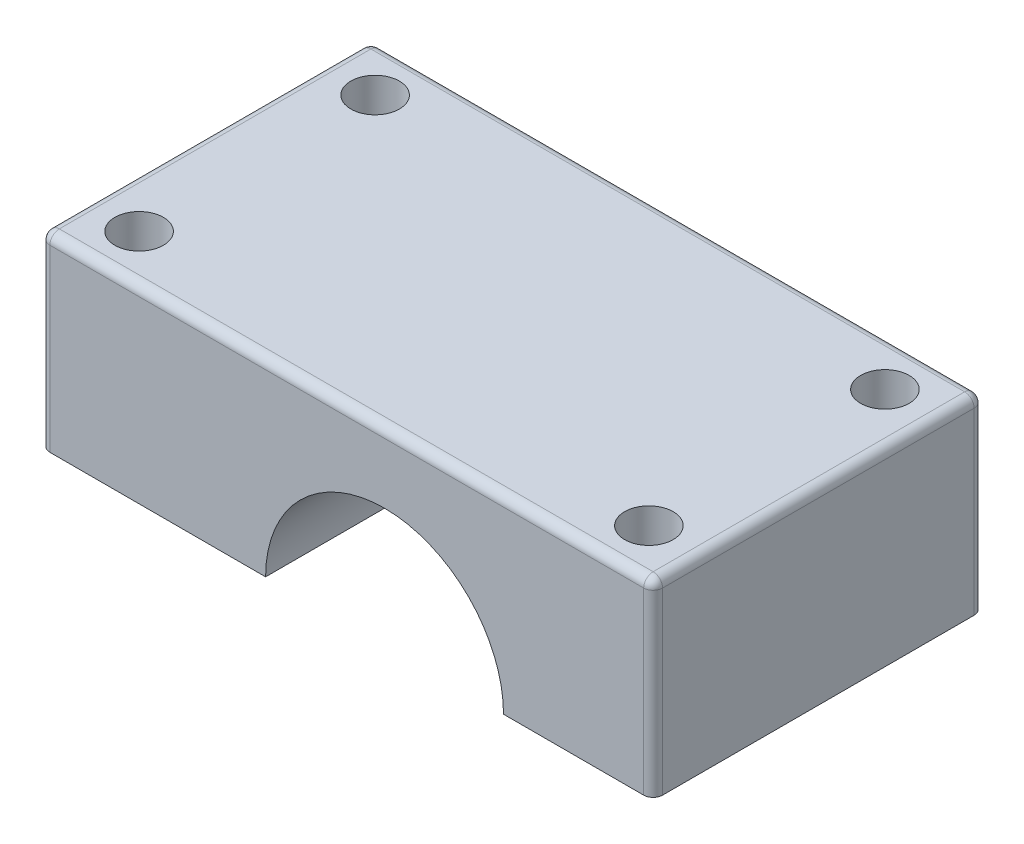
from build123d import *

# Parameters (mm, degrees)
SKETCH1_W               = 72.263
SKETCH1_H               = 44.45
BOSS_EXTRUDE1_DEPTH     = 12.7
CUT_EXTRUDE1_DEPTH      = 59.673484576
SKETCH3_W               = 44.45
SKETCH3_H               = 25.4
BOSS_EXTRUDE2_DEPTH     = 10.16
F_1_4_CLEARANCE_HOLE1_D = 6.5278
FILLET8_R               = 1.27


with BuildPart() as part:
    # Sketch1 → Boss-Extrude1 (new, symmetric)
    with BuildSketch(Plane(origin=(0, 0, 0), x_dir=(1, 0, 0), z_dir=(0, 1, 0))):
        Rectangle(SKETCH1_W, SKETCH1_H)
    extrude(amount=BOSS_EXTRUDE1_DEPTH, both=True)

    # Sketch2 → Cut-Extrude1 (cut, through all)
    with BuildSketch(Plane.XY.offset(22.225)):
        with BuildLine():
            Line((-16.002, -12.7), (16.002, -12.7))
            ThreePointArc((16.002, -12.7), (0, 3.302), (-16.002, -12.7))
        make_face()
    extrude(amount=-CUT_EXTRUDE1_DEPTH, mode=Mode.SUBTRACT)

    # Sketch3 → Boss-Extrude2 (add)
    with BuildSketch(Plane.ZY.offset(36.1315)):
        Rectangle(SKETCH3_W, SKETCH3_H)
    extrude(amount=BOSS_EXTRUDE2_DEPTH)

    # 1/4 Clearance Hole1 (through all)
    with Locations(Plane(origin=(-39.37, -12.7, 15.875), x_dir=(0, 0, -1), z_dir=(0, -1, 0))):
        with Locations((0, 0), (0, 68.58), (31.75, 68.58), (31.75, 0)):
            Hole(F_1_4_CLEARANCE_HOLE1_D / 2)

    # Fillet8
    fillet8_edges = [part.edges().sort_by_distance(p)[0] for p in [
        (-5.08, 12.7, 22.225),
        (-46.2915, 0, -22.225),
        (-46.2915, 0, 22.225),
        (-46.2915, 12.7, 0),
        (36.1315, 12.7, 0),
        (-5.08, 12.7, -22.225),
        (36.1315, 0, 22.225),
        (36.1315, 0, -22.225),
    ]]
    fillet(fillet8_edges, radius=FILLET8_R)


solid = part.part
